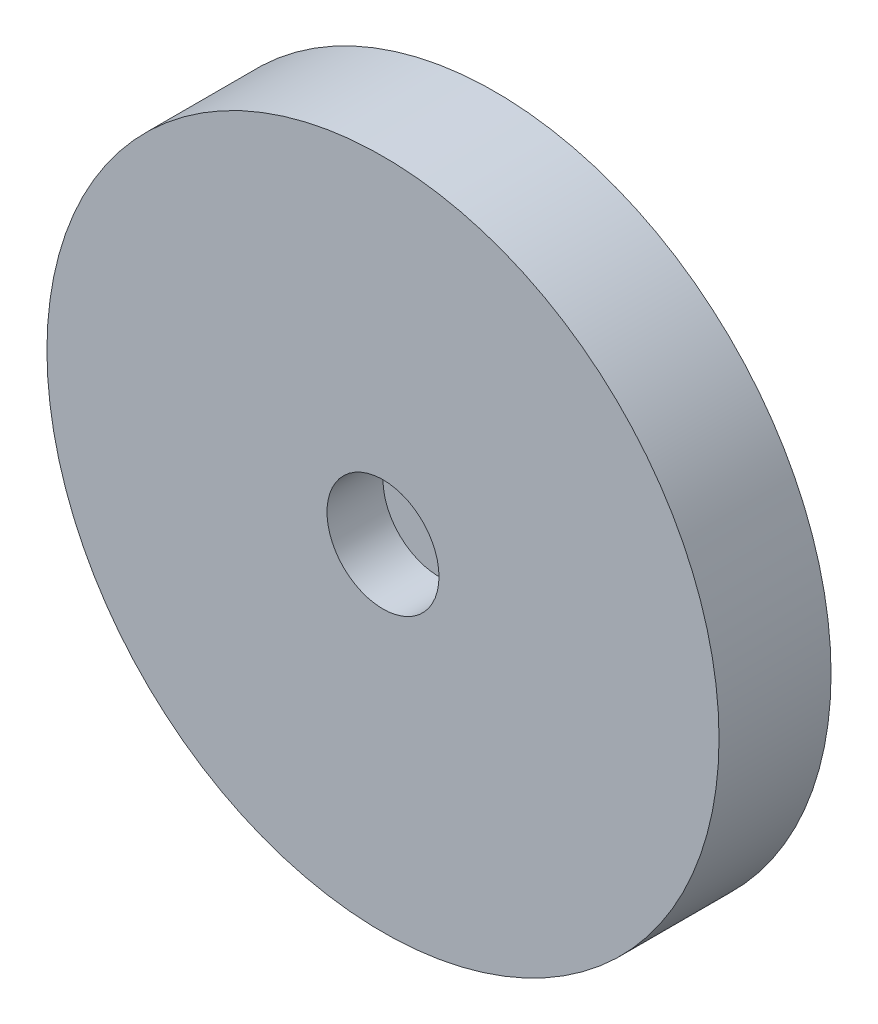
from build123d import *

# Parameters (mm, degrees)
SKETCH2_R           = 150
BOSS_EXTRUDE1_DEPTH = 50
SKETCH3_R           = 25
CUT_EXTRUDE1_DEPTH  = 25


with BuildPart() as part:
    # Sketch2 → Boss-Extrude1 (new body)
    with BuildSketch(Plane.XY):
        Circle(SKETCH2_R)
    extrude(amount=BOSS_EXTRUDE1_DEPTH)

    # Sketch3 → Cut-Extrude1 (cut)
    with BuildSketch(Plane.XY.offset(50)):
        Circle(SKETCH3_R)
    extrude(amount=-CUT_EXTRUDE1_DEPTH, mode=Mode.SUBTRACT)


solid = part.part
